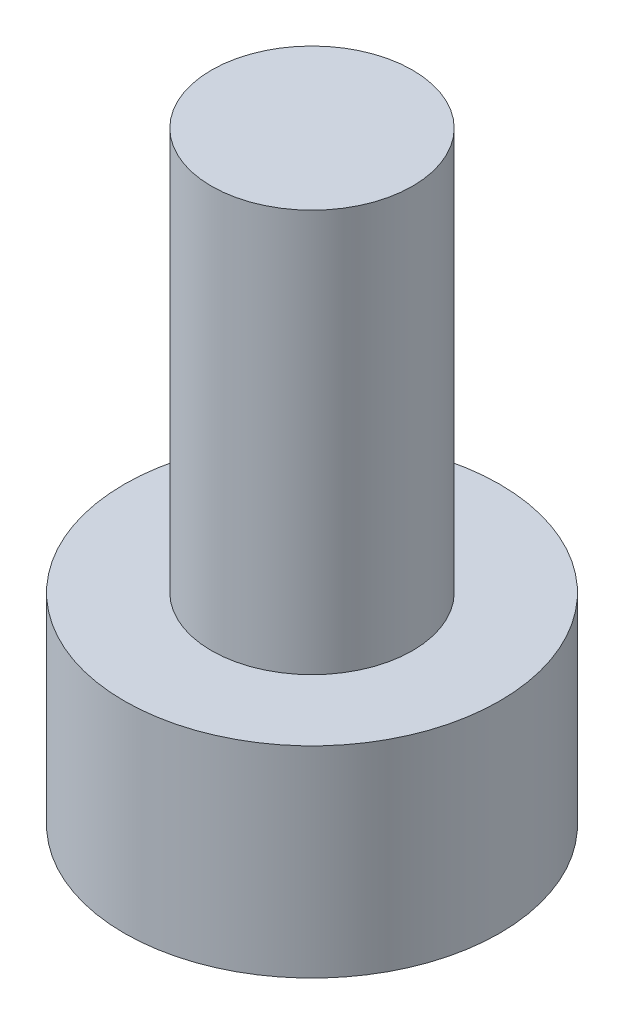
from build123d import *

# Parameters (mm, degrees)
SKETCH_1_R          = 2.8
EXTRUDE_1_DEPTH     = 3
SKETCH_2_R          = 1.5
EXTRUDE_2_DEPTH     = 6
CUT_EXTRUDE_1_DEPTH = 1


with BuildPart() as part:
    # 草图1 → 凸台-拉伸1 (new body)
    with BuildSketch(Plane(origin=(0, 0, 0), x_dir=(1, 0, 0), z_dir=(0, 1, 0))):
        with Locations(Location((0, 0, 0), (0, 0, 270))):
            Circle(SKETCH_1_R)
    extrude(amount=EXTRUDE_1_DEPTH)

    # 草图2 → 凸台-拉伸2 (add)
    with BuildSketch(Plane(origin=(0, 3, 0), x_dir=(1, 0, 0), z_dir=(0, 1, 0))):
        with Locations(Location((0, 0, 0), (0, 0, 270))):
            Circle(SKETCH_2_R)
    extrude(amount=EXTRUDE_2_DEPTH)

    # 草图3 → 切除-拉伸1 (cut)
    with BuildSketch(Plane.XZ):
        Polygon((0, 1.443375673), (-1.25, 0.721687836), (-1.25, -0.721687836), (0, -1.443375673), (1.25, -0.721687836), (1.25, 0.721687836), align=None)
    extrude(amount=-CUT_EXTRUDE_1_DEPTH, mode=Mode.SUBTRACT)


solid = part.part
